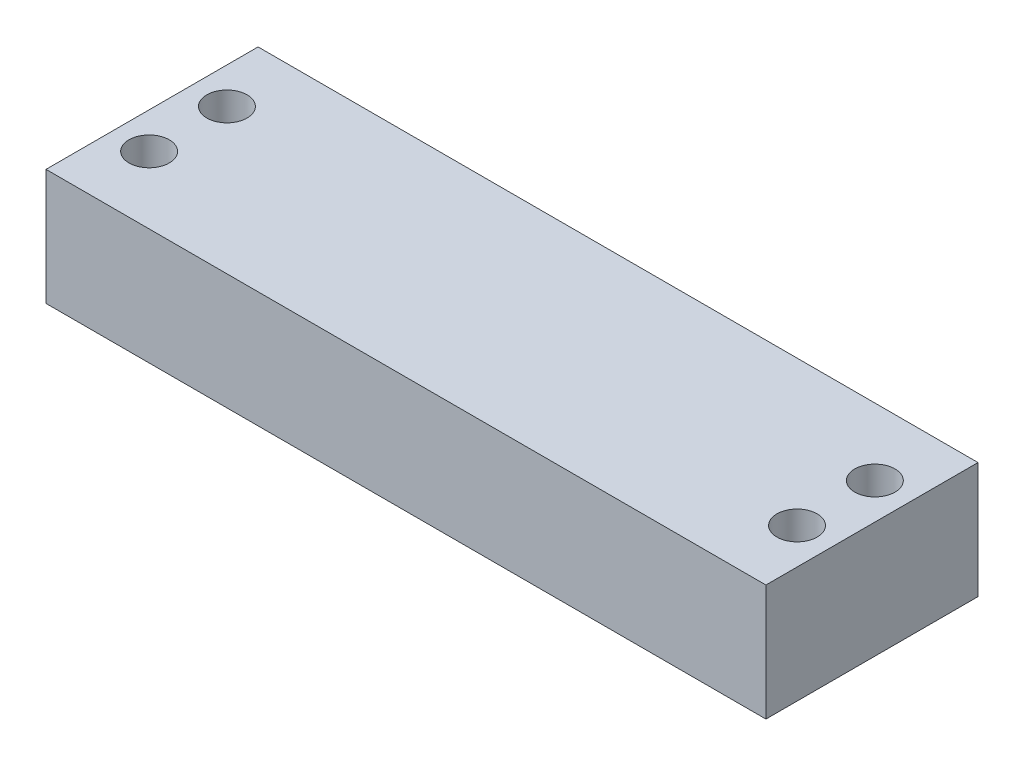
from build123d import *

# Parameters (mm, degrees)
SKETCH1_W           = 74
SKETCH1_H           = 21.8
SKETCH1_R           = 2.0701
BOSS_EXTRUDE1_DEPTH = 11.938


with BuildPart() as part:
    # Sketch1 → Boss-Extrude1 (new body)
    with BuildSketch(Plane(origin=(0, 0, 0), x_dir=(1, 0, 0), z_dir=(0, 1, 0))):
        with Locations((37, 10.9)):
            Rectangle(SKETCH1_W, SKETCH1_H)
        with Locations(Location((3.7, 6.9, 0), (0, 0, 270))):
            Circle(SKETCH1_R, mode=Mode.SUBTRACT)
        with Locations(Location((3.7, 14.9, 0), (0, 0, 90))):
            Circle(SKETCH1_R, mode=Mode.SUBTRACT)
        with Locations(Location((70.3, 6.9, 0), (0, 0, 90))):
            Circle(SKETCH1_R, mode=Mode.SUBTRACT)
        with Locations(Location((70.3, 14.9, 0), (0, 0, 270))):
            Circle(SKETCH1_R, mode=Mode.SUBTRACT)
    extrude(amount=BOSS_EXTRUDE1_DEPTH)


solid = part.part
